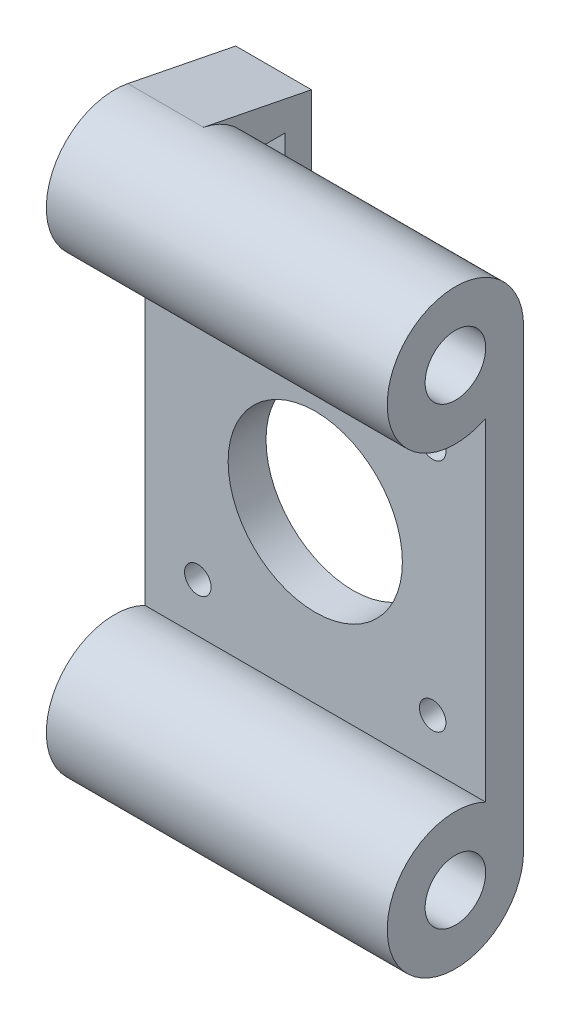
from build123d import *

# Parameters (mm, degrees)
ESBO_O1_W                = 45
ESBO_O1_H                = 45
ESBO_O1_R                = 1.75
ESBO_O1_R_2              = 11.5
RESSALTO_EXTRUS_O1_DEPTH = 5
ESBO_O3_R                = 4
RESSALTO_EXTRUS_O2_DEPTH = 45
RESSALTO_EXTRUS_O3_DEPTH = 10
ESBO_O5_R                = 1.75
CORTE_EXTRUS_O2_DEPTH    = 15


with BuildPart() as part:
    # Esboço1 → Ressalto-extrusão1 (new body)
    with BuildSketch(Plane.XY):
        Rectangle(ESBO_O1_W, ESBO_O1_H)
        with Locations((-15.5, 15.5)):
            Circle(ESBO_O1_R, mode=Mode.SUBTRACT)
        with Locations((15.5, 15.5)):
            Circle(ESBO_O1_R, mode=Mode.SUBTRACT)
        with Locations((15.5, -15.5)):
            Circle(ESBO_O1_R, mode=Mode.SUBTRACT)
        with Locations((-15.5, -15.5)):
            Circle(ESBO_O1_R, mode=Mode.SUBTRACT)
        Circle(ESBO_O1_R_2, mode=Mode.SUBTRACT)
    extrude(amount=RESSALTO_EXTRUS_O1_DEPTH)

    # Esboço3 → Ressalto-extrusão2 (add)
    # profile 1 of 2: a face of its own
    with BuildSketch(Plane.ZY.offset(22.5)):
        with BuildLine():
            Line((0, 30), (0, 21.937742252))
            Line((0, 21.937742252), (5, 21.937742252))
            ThreePointArc((5, 21.937742252), (16.64852927, 34.74341649), (0, 30))
        make_face()
        with Locations(Location((9, 30, 0), (0, 0, 270))):
            Circle(ESBO_O3_R, mode=Mode.SUBTRACT)
    # profile 2 of 2: a face of its own
    with BuildSketch(Plane.ZY.offset(22.5)):
        with BuildLine():
            Line((5, -21.937742252), (0, -21.937742252))
            Line((0, -21.937742252), (0, -30))
            ThreePointArc((0, -30), (16.64852927, -34.74341649), (5, -21.937742252))
        make_face()
        with Locations(Location((9, -30, 0), (0, 0, 270))):
            Circle(ESBO_O3_R, mode=Mode.SUBTRACT)
    extrude(amount=-RESSALTO_EXTRUS_O2_DEPTH)

    # Esboço4 → Ressalto-extrusão3 (add)
    # profile 1 of 2: a face of its own
    with BuildSketch(Plane.ZY.offset(22.5)):
        Polygon((7.247929139, 38.827811037), (-7, 36), (-7, 24), (0, 22.610697943), align=None)
        Polygon((0, 30), (0, 32.8), (-3.5, 32.8), (-3.5, 27.2), (0, 27.2), align=None, mode=Mode.SUBTRACT)
    # profile 2 of 2: a face of its own
    with BuildSketch(Plane.ZY.offset(22.5)):
        Polygon((7.247929139, -38.827811037), (0, -22.610697943), (-7, -24), (-7, -36), align=None)
        Polygon((0, -27.2), (0, -30), (0, -32.8), (-3.5, -32.8), (-3.5, -27.2), align=None, mode=Mode.SUBTRACT)
    extrude(amount=-RESSALTO_EXTRUS_O3_DEPTH)

    # Esboço5 → Corte-extrusão2 (cut)
    with BuildSketch(Plane(origin=(0, 0, -7), x_dir=(-1, 0, 0), z_dir=(0, 0, -1))):
        with Locations((17.5, 30)):
            Circle(ESBO_O5_R)
        with Locations((17.5, -30)):
            Circle(ESBO_O5_R)
    extrude(amount=-CORTE_EXTRUS_O2_DEPTH, mode=Mode.SUBTRACT)


solid = part.part
